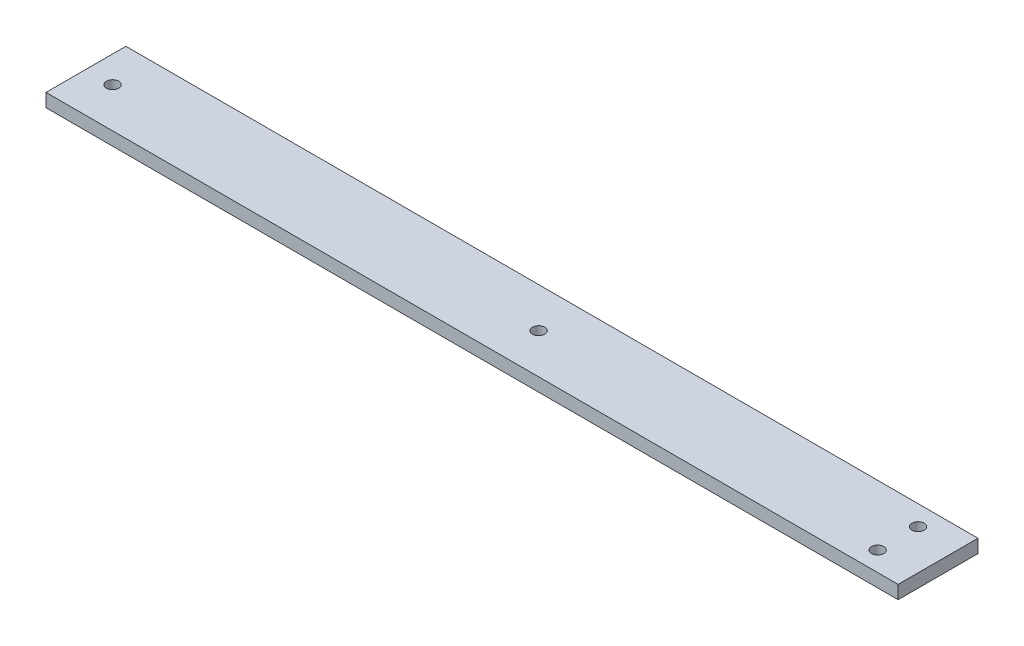
from build123d import *

# Parameters (mm, degrees)
SKETCH1_W           = 203.2
SKETCH1_H           = 19.05
SKETCH1_R           = 1.4605
BOSS_EXTRUDE1_DEPTH = 3.175
SKETCH2_R           = 1.4605
CUT_EXTRUDE1_DEPTH  = 9.525


with BuildPart() as part:
    # Sketch1 → Boss-Extrude1 (new body)
    with BuildSketch(Plane(origin=(0, 0, 0), x_dir=(1, 0, 0), z_dir=(0, 1, 0))):
        with Locations((101.6, 9.525)):
            Rectangle(SKETCH1_W, SKETCH1_H)
        with Locations(Location((6.35, 9.525, 0), (0, 0, 270))):
            Circle(SKETCH1_R, mode=Mode.SUBTRACT)
        with Locations(Location((107.95, 9.525, 0), (0, 0, 270))):
            Circle(SKETCH1_R, mode=Mode.SUBTRACT)
    extrude(amount=BOSS_EXTRUDE1_DEPTH)

    # Sketch2 → Cut-Extrude1 (cut)
    with BuildSketch(Plane(origin=(0, 3.175, 0), x_dir=(1, 0, 0), z_dir=(0, 1, 0))):
        with Locations(Location((193.675, 14.2875, 0), (0, 0, 270))):
            Circle(SKETCH2_R)
        with Locations(Location((193.675, 4.6355, 0), (0, 0, 270))):
            Circle(SKETCH2_R)
    extrude(amount=-CUT_EXTRUDE1_DEPTH, mode=Mode.SUBTRACT)


solid = part.part
